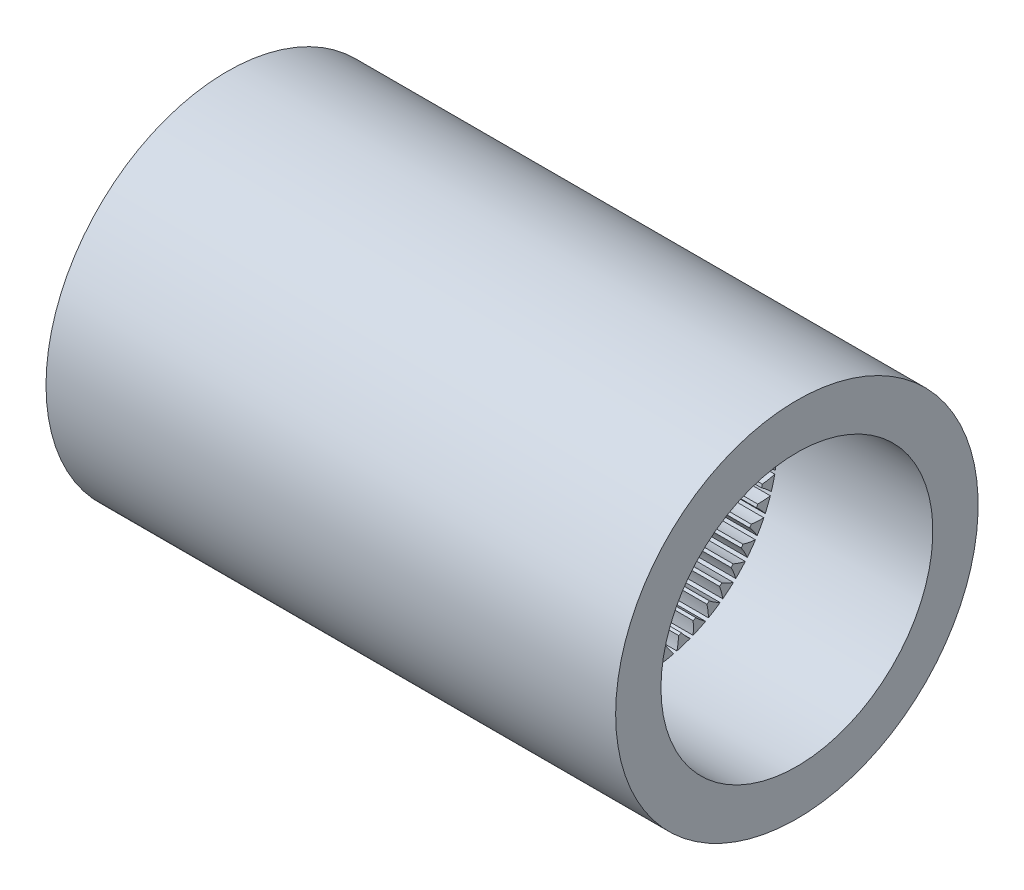
from build123d import *

# Parameters (mm, degrees)
BASPROSKE_W             = 15
BASPROSKE_H             = 5.5
TOOTHCUT_DEPTH          = 29.939592257
TEETHCUTS_COUNT         = 50
TEETHCUTS_ANGLE         = 352.8
BOSS_EXTRU_1_DEPTH      = 25
BOSS_EXTRU_1_DEPTH_BACK = 30
ESQUISSE1_R             = 17.5
ESQUISSE1_R_2           = 13.126


with BuildPart() as part:
    # BasProSke → Base-Revolve (revolve)
    with BuildSketch(Plane(origin=(0, 0, 0), x_dir=(1, 0, 0), z_dir=(0, 1, 0))):
        with Locations((7.5, 14.75)):
            Rectangle(BASPROSKE_W, BASPROSKE_H)
    revolve(axis=Axis((-10, 0, 0), (1, 0, 0)))

    # TooCutSke → ToothCut (cut, through all)
    with BuildSketch(Plane(origin=(0, 0, 0), x_dir=(0, 0, -1), z_dir=(1, 0, 0))):
        with BuildLine():
            ThreePointArc((0.61780052, 11.958652419), (0.416268173, 12.553476698), (0.156057275, 13.125072271))
            ThreePointArc((0.156057275, 13.125072271), (0, 13.126), (-0.156057275, 13.125072271))
            ThreePointArc((-0.156057275, 13.125072271), (-0.416268173, 12.553476698), (-0.61780052, 11.958652419))
            ThreePointArc((-0.61780052, 11.958652419), (0, 11.9746), (0.61780052, 11.958652419))
        make_face()
    toothcut = extrude(amount=TOOTHCUT_DEPTH, mode=Mode.SUBTRACT)

    # TeethCuts: ToothCut ×50 about axis
    teethcuts_axis = Axis((-10, 0, 0), (1, 0, 0))
    for i in range(1, TEETHCUTS_COUNT):
        add(toothcut.rotate(teethcuts_axis, i * TEETHCUTS_ANGLE / (TEETHCUTS_COUNT - 1)), mode=Mode.SUBTRACT)

    # Esquisse1 → Boss.-Extru.1 (add, two sides: drawn at the far end of the back side and taken through both)
    with BuildSketch(Plane.ZY.offset(-BOSS_EXTRU_1_DEPTH_BACK)):
        Circle(ESQUISSE1_R)
        Circle(ESQUISSE1_R_2, mode=Mode.SUBTRACT)
    extrude(amount=BOSS_EXTRU_1_DEPTH + BOSS_EXTRU_1_DEPTH_BACK)


solid = part.part
